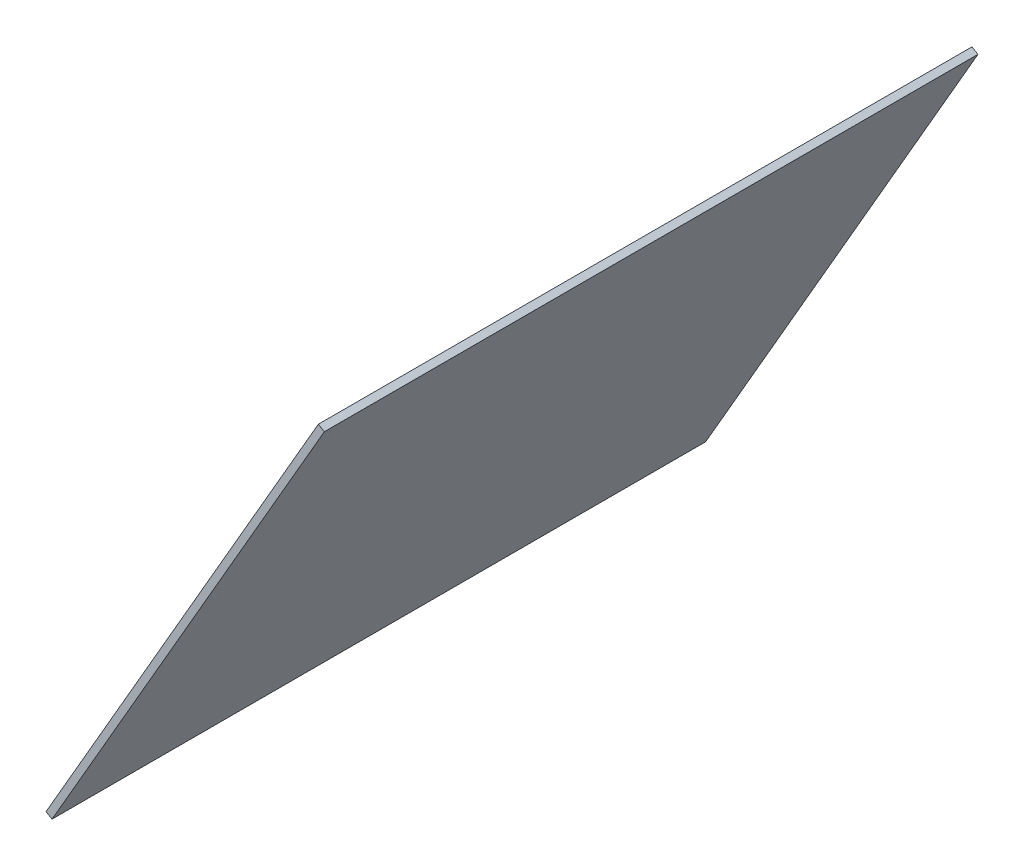
from build123d import *

# Parameters (mm, degrees)
BOSS_EXTRUDE1_DEPTH = 282


with BuildPart() as part:
    # Sketch2 → Boss-Extrude1 (new body)
    with BuildSketch(Plane.XY.offset(279)):
        Polygon((146.324865405, 0), (263.824865405, 203.515969889), (266.422941617, 202.015969889), (148.922941617, -1.5), align=None)
    extrude(amount=-BOSS_EXTRUDE1_DEPTH)


solid = part.part
